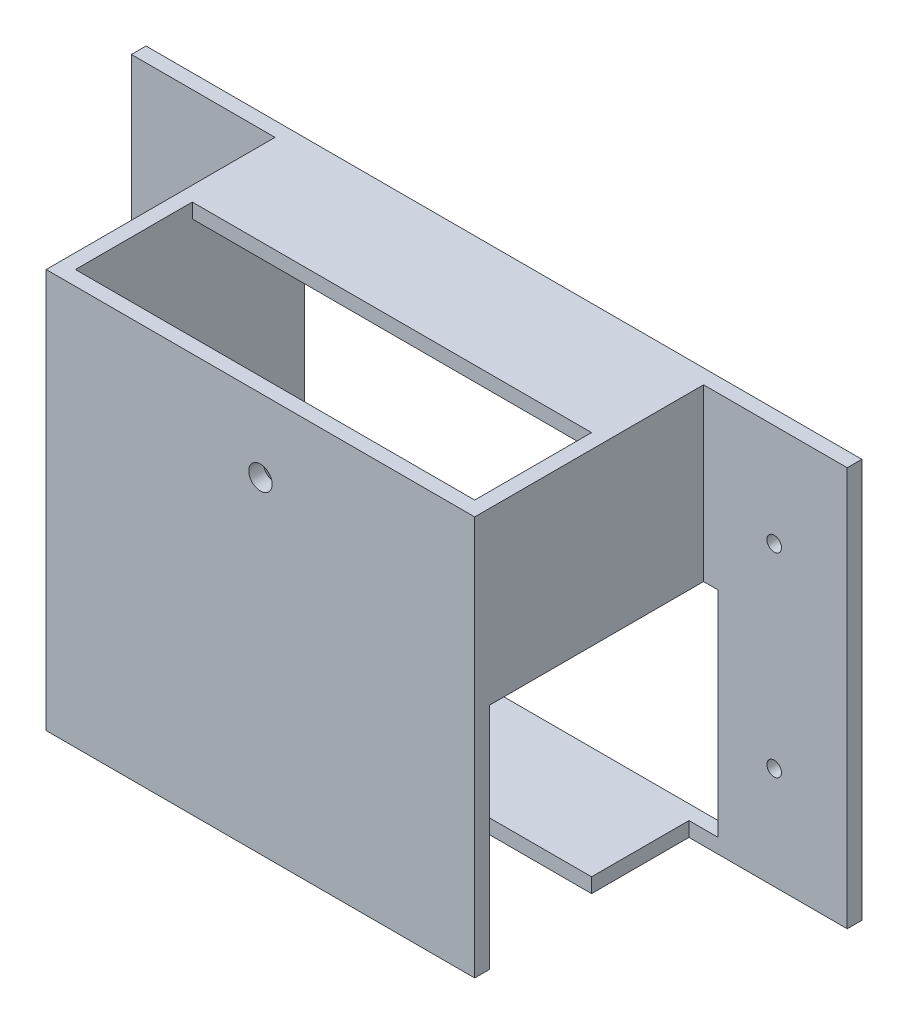
from build123d import *

# Parameters (mm, degrees)
SKETCH_1_W          = 147
SKETCH_1_H          = 82
EXTRUDE_1_DEPTH     = 50
SKETCH_2_W          = 29.5
SKETCH_2_H          = 82
CUT_EXTRUDE_1_DEPTH = 47
SKETCH_3_W          = 29.5
SKETCH_3_H          = 82
CUT_EXTRUDE_2_DEPTH = 47
SKETCH_5_W          = 82
SKETCH_5_H          = 76
CUT_EXTRUDE_3_DEPTH = 47
SKETCH_6_R          = 2.4
CUT_EXTRUDE_4_DEPTH = 4
SKETCH_7_W          = 82
SKETCH_7_H          = 24
CUT_EXTRUDE_5_DEPTH = 84
SKETCH_9_W          = 44
SKETCH_9_H          = 47
CUT_EXTRUDE_6_DEPTH = 3
SKETCH_10_W         = 6
SKETCH_10_H         = 44
CUT_EXTRUDE_7_DEPTH = 7
SKETCH_12_R         = 1.5
CUT_EXTRUDE_8_DEPTH = 3


with BuildPart() as part:
    # 草图1 → 凸台-拉伸1 (new body)
    with BuildSketch(Plane.XY):
        with Locations((-4.960122699, -1.995398773)):
            Rectangle(SKETCH_1_W, SKETCH_1_H)
    extrude(amount=EXTRUDE_1_DEPTH)

    # 草图2 → 切除-拉伸1 (cut)
    with BuildSketch(Plane.XY.offset(50)):
        with Locations((-63.710122699, -1.995398773)):
            Rectangle(SKETCH_2_W, SKETCH_2_H)
    extrude(amount=-CUT_EXTRUDE_1_DEPTH, mode=Mode.SUBTRACT)

    # 草图3 → 切除-拉伸2 (cut)
    with BuildSketch(Plane.XY.offset(50)):
        with Locations((53.789877301, -1.995398773)):
            Rectangle(SKETCH_3_W, SKETCH_3_H)
    extrude(amount=-CUT_EXTRUDE_2_DEPTH, mode=Mode.SUBTRACT)

    # 草图5 → 切除-拉伸3 (cut)
    with BuildSketch(Plane(origin=(0, 0, 0), x_dir=(-1, 0, 0), z_dir=(0, 0, -1))):
        with Locations((4.960122699, -1.995398773)):
            Rectangle(SKETCH_5_W, SKETCH_5_H)
    extrude(amount=-CUT_EXTRUDE_3_DEPTH, mode=Mode.SUBTRACT)

    # 草图6 → 切除-拉伸4 (cut)
    with BuildSketch(Plane.XY.offset(50)):
        with Locations((-4.960122699, 24.004601227)):
            Circle(SKETCH_6_R)
    extrude(amount=-CUT_EXTRUDE_4_DEPTH, mode=Mode.SUBTRACT)

    # 草图7 → 切除-拉伸5 (cut)
    with BuildSketch(Plane(origin=(0, 39.004601227, 0), x_dir=(1, 0, 0), z_dir=(0, 1, 0))):
        with Locations((-4.960122699, -35)):
            Rectangle(SKETCH_7_W, SKETCH_7_H)
    extrude(amount=-CUT_EXTRUDE_5_DEPTH, mode=Mode.SUBTRACT)

    # 草图9 → 切除-拉伸6 (cut)
    with BuildSketch(Plane(origin=(39.039877301, 0, 0), x_dir=(0, 0, -1), z_dir=(1, 0, 0))):
        with Locations((-25, -19.495398773)):
            Rectangle(SKETCH_9_W, SKETCH_9_H)
    extrude(amount=-CUT_EXTRUDE_6_DEPTH, mode=Mode.SUBTRACT)

    # 草图10 → 切除-拉伸7 (cut)
    with BuildSketch(Plane.XY.offset(3)):
        with Locations((39.039877301, -17.995398773)):
            Rectangle(SKETCH_10_W, SKETCH_10_H)
    extrude(amount=-CUT_EXTRUDE_7_DEPTH, mode=Mode.SUBTRACT)

    # 草图12 → 切除-拉伸8 (cut)
    with BuildSketch(Plane(origin=(0, 0, 0), x_dir=(-1, 0, 0), z_dir=(0, 0, -1))):
        with Locations((63.460122699, 18.004601227)):
            Circle(SKETCH_12_R)
        with Locations((63.460122699, -21.995398773)):
            Circle(SKETCH_12_R)
        with Locations((-53.539877301, 18.004601227)):
            Circle(SKETCH_12_R)
        with Locations((-53.539877301, -21.995398773)):
            Circle(SKETCH_12_R)
    extrude(amount=-CUT_EXTRUDE_8_DEPTH, mode=Mode.SUBTRACT)


solid = part.part
